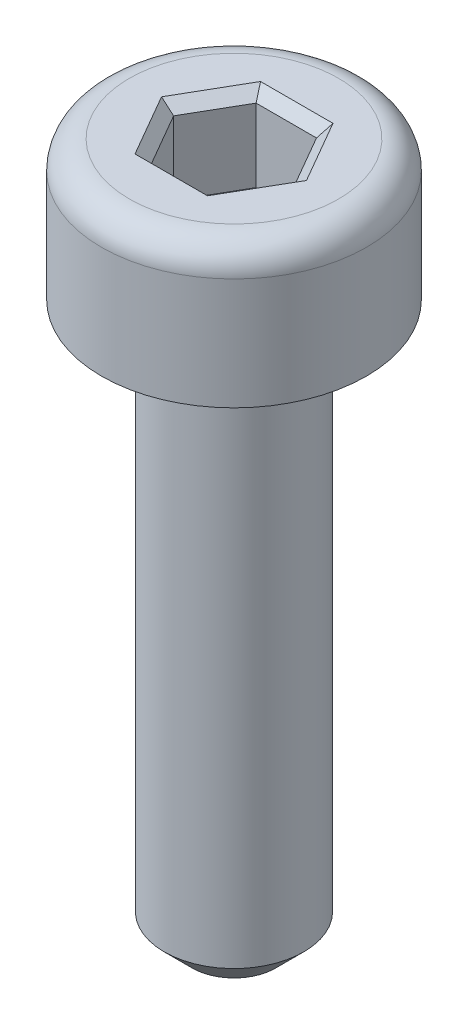
from build123d import *

# Parameters (mm, degrees)
ENL_V_MAT_EXTRU_1_DEPTH = 1.2
CHANFREIN1_SIZE         = 0.15


with BuildPart() as part:
    # Esquisse1 → Révolution1 (revolve)
    with BuildSketch(Plane.XY, mode=Mode.PRIVATE) as r_volution1_sk:
        with BuildLine():
            Line((1, -7.6), (0.6, -8))
            Line((0.6, -8), (0, -8))
            Line((0, -8), (0, 2))
            Line((0, 2), (1.5, 2))
            ThreePointArc((1.5, 2), (1.782842712, 1.882842712), (1.9, 1.6))
            Line((1.9, 1.6), (1.9, 0))
            Line((1.9, 0), (1, 0))
            Line((1, 0), (1, -7.6))
        make_face()
    revolve(r_volution1_sk.sketch.rotate(Axis((0, 6.972972973, 0), (0, -1, 0)), 90), axis=Axis((0, 6.972972973, 0), (0, -1, 0)))

    # Esquisse2 → Enlèv. mat.-Extru.1 (cut)
    with BuildSketch(Plane(origin=(0, 2, 0), x_dir=(1, 0, 0), z_dir=(0, 1, 0))):
        Polygon((-0.866025404, 0), (-0.433012702, -0.75), (0.433012702, -0.75), (0.866025404, 0), (0.433012702, 0.75), (-0.433012702, 0.75), align=None)
    extrude(amount=-ENL_V_MAT_EXTRU_1_DEPTH, mode=Mode.SUBTRACT)

    # Chanfrein1
    chanfrein1_edges = [part.edges().sort_by_distance(p)[0] for p in [
        (-0.649519053, 2, -0.375),
        (-0.649519053, 2, 0.375),
        (0, 2, 0.75),
        (0.649519053, 2, 0.375),
        (0.649519053, 2, -0.375),
        (0, 2, -0.75),
    ]]
    chamfer(chanfrein1_edges, length=CHANFREIN1_SIZE)


solid = part.part
